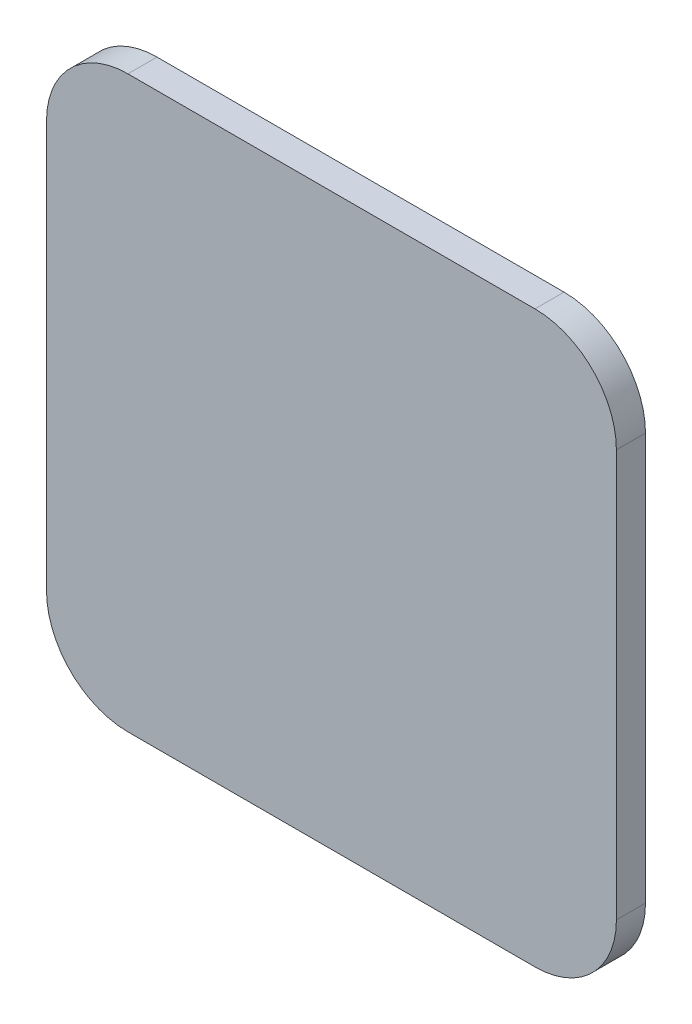
from build123d import *

# Parameters (mm, degrees)
BOSS_EXTRUDE1_DEPTH = 1.27
BOSS_EXTRUDE2_DEPTH = 2.54
SKETCH2_W           = 17.018
SKETCH2_H           = 17.018
CUT_EXTRUDE1_DEPTH  = 1.778


with BuildPart() as part:
    # Sketch1 → Boss-Extrude1 (new body)
    with BuildSketch(Plane.XY):
        with BuildLine():
            ThreePointArc((9.248726154, -31.75), (8.207197868, -29.235528286), (5.692726154, -28.194))
            Line((5.692726154, -28.194), (-12.087273846, -28.194))
            ThreePointArc((-12.087273846, -28.194), (-14.60174556, -29.235528286), (-15.643273846, -31.75))
            Line((-15.643273846, -31.75), (-15.643273846, -49.53))
            ThreePointArc((-15.643273846, -49.53), (-14.60174556, -52.044471714), (-12.087273846, -53.086))
            Line((-12.087273846, -53.086), (5.692726154, -53.086))
            ThreePointArc((5.692726154, -53.086), (8.207197868, -52.044471714), (9.248726154, -49.53))
            Line((9.248726154, -49.53), (9.248726154, -31.75))
        make_face()
        with BuildLine():
            Line((6.581726154, -31.75), (6.581726154, -49.53))
            ThreePointArc((6.581726154, -49.53), (6.321344082, -50.158617928), (5.692726154, -50.419))
            Line((5.692726154, -50.419), (-12.087273846, -50.419))
            ThreePointArc((-12.087273846, -50.419), (-12.715891775, -50.158617928), (-12.976273846, -49.53))
            Line((-12.976273846, -49.53), (-12.976273846, -31.75))
            ThreePointArc((-12.976273846, -31.75), (-12.715891775, -31.121382072), (-12.087273846, -30.861))
            Line((-12.087273846, -30.861), (5.692726154, -30.861))
            ThreePointArc((5.692726154, -30.861), (6.321344082, -31.121382072), (6.581726154, -31.75))
        make_face(mode=Mode.SUBTRACT)
    extrude(amount=-BOSS_EXTRUDE1_DEPTH)

    # Sketch1<3> → Boss-Extrude2 (add)
    with BuildSketch(Plane.XY):
        with BuildLine():
            ThreePointArc((5.692726154, -50.419), (6.321344082, -50.158617928), (6.581726154, -49.53))
            Line((6.581726154, -49.53), (6.581726154, -31.75))
            ThreePointArc((6.581726154, -31.75), (6.321344082, -31.121382072), (5.692726154, -30.861))
            Line((5.692726154, -30.861), (-12.087273846, -30.861))
            ThreePointArc((-12.087273846, -30.861), (-12.715891775, -31.121382072), (-12.976273846, -31.75))
            Line((-12.976273846, -31.75), (-12.976273846, -49.53))
            ThreePointArc((-12.976273846, -49.53), (-12.715891775, -50.158617928), (-12.087273846, -50.419))
            Line((-12.087273846, -50.419), (5.692726154, -50.419))
        make_face()
    extrude(amount=-BOSS_EXTRUDE2_DEPTH)

    # Sketch2 → Cut-Extrude1 (cut)
    with BuildSketch(Plane(origin=(0, 0, -2.54), x_dir=(-1, 0, 0), z_dir=(0, 0, -1))):
        with Locations((3.197273846, -40.64)):
            Rectangle(SKETCH2_W, SKETCH2_H)
    extrude(amount=-CUT_EXTRUDE1_DEPTH, mode=Mode.SUBTRACT)


solid = part.part
